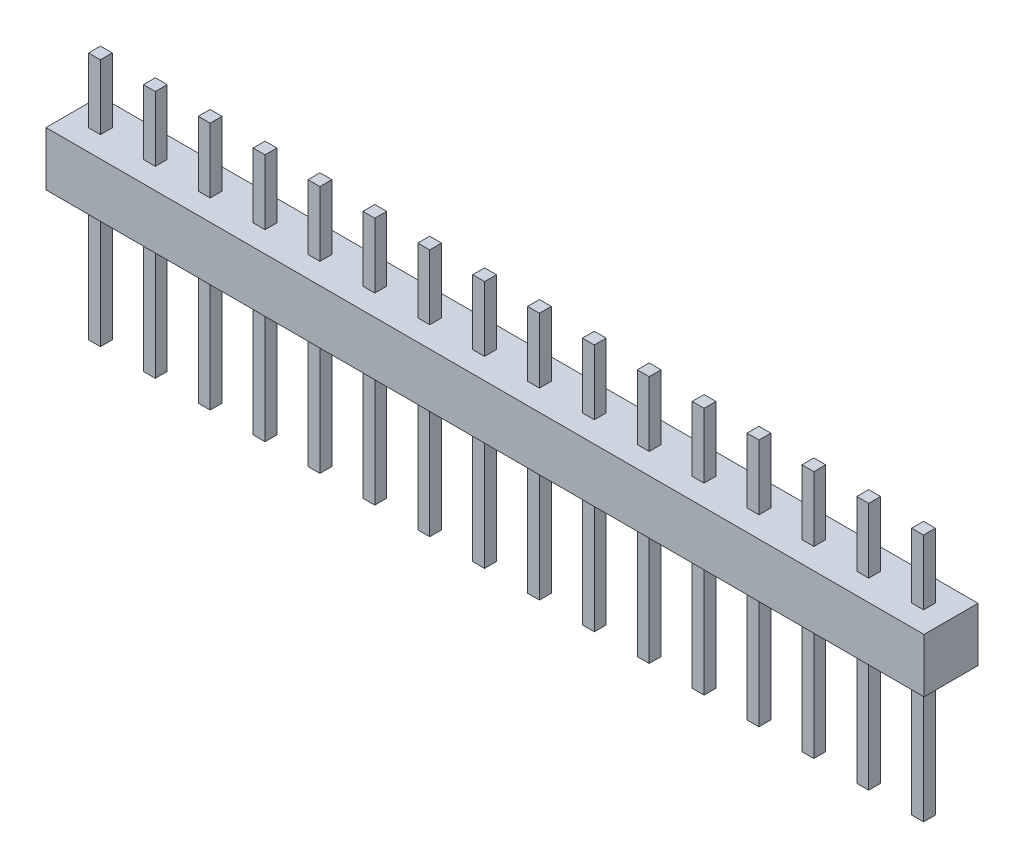
from build123d import *

# Parameters (mm, degrees)
SKETCH1_W              = 40.64
SKETCH1_H              = 2.5
BOSS_EXTRUDE1_DEPTH    = 1.25
SKETCH2_W              = 0.55
SKETCH2_H              = 0.55
BOSS_EXTRUDE2_DEPTH    = 6
BOSS_EXTRUDE2_2_DEPTH  = 6
BOSS_EXTRUDE2_3_DEPTH  = 6
BOSS_EXTRUDE2_4_DEPTH  = 6
BOSS_EXTRUDE2_5_DEPTH  = 6
BOSS_EXTRUDE2_6_DEPTH  = 6
BOSS_EXTRUDE2_7_DEPTH  = 6
BOSS_EXTRUDE2_8_DEPTH  = 6
BOSS_EXTRUDE2_9_DEPTH  = 6
BOSS_EXTRUDE2_10_DEPTH = 6
BOSS_EXTRUDE2_11_DEPTH = 6
BOSS_EXTRUDE2_12_DEPTH = 6
BOSS_EXTRUDE2_13_DEPTH = 6
BOSS_EXTRUDE2_14_DEPTH = 6
BOSS_EXTRUDE2_15_DEPTH = 6
BOSS_EXTRUDE2_16_DEPTH = 6
SKETCH2_2_W            = 0.55
SKETCH2_2_H            = 0.55
BOSS_EXTRUDE3_DEPTH    = 5.5
BOSS_EXTRUDE3_2_DEPTH  = 5.5
BOSS_EXTRUDE3_3_DEPTH  = 5.5
BOSS_EXTRUDE3_4_DEPTH  = 5.5
BOSS_EXTRUDE3_5_DEPTH  = 5.5
BOSS_EXTRUDE3_6_DEPTH  = 5.5
BOSS_EXTRUDE3_7_DEPTH  = 5.5
BOSS_EXTRUDE3_8_DEPTH  = 5.5
BOSS_EXTRUDE3_9_DEPTH  = 5.5
BOSS_EXTRUDE3_10_DEPTH = 5.5
BOSS_EXTRUDE3_11_DEPTH = 5.5
BOSS_EXTRUDE3_12_DEPTH = 5.5
BOSS_EXTRUDE3_13_DEPTH = 5.5
BOSS_EXTRUDE3_14_DEPTH = 5.5
BOSS_EXTRUDE3_15_DEPTH = 5.5
BOSS_EXTRUDE3_16_DEPTH = 5.5


with BuildPart() as part:
    # Sketch1 → Boss-Extrude1 (new, symmetric)
    with BuildSketch(Plane.XY):
        with Locations((20.32, 1.25)):
            Rectangle(SKETCH1_W, SKETCH1_H)
    extrude(amount=BOSS_EXTRUDE1_DEPTH, both=True)


with BuildPart() as body_2:
    # Sketch2 → Boss-Extrude2 (new body)
    with BuildSketch(Plane.XZ):
        with Locations((3.81, 0)):
            Rectangle(SKETCH2_W, SKETCH2_H)
    extrude(amount=BOSS_EXTRUDE2_DEPTH)


with BuildPart() as body_3:
    # Sketch2 → Boss-Extrude2 2 (new body)
    with BuildSketch(Plane.XZ):
        with Locations((1.27, 0)):
            Rectangle(SKETCH2_W, SKETCH2_H)
    extrude(amount=BOSS_EXTRUDE2_2_DEPTH)


with BuildPart() as body_4:
    # Sketch2 → Boss-Extrude2 3 (new body)
    with BuildSketch(Plane.XZ):
        with Locations((6.35, 0)):
            Rectangle(SKETCH2_W, SKETCH2_H)
    extrude(amount=BOSS_EXTRUDE2_3_DEPTH)


with BuildPart() as body_5:
    # Sketch2 → Boss-Extrude2 4 (new body)
    with BuildSketch(Plane.XZ):
        with Locations((8.89, 0)):
            Rectangle(SKETCH2_W, SKETCH2_H)
    extrude(amount=BOSS_EXTRUDE2_4_DEPTH)


with BuildPart() as body_6:
    # Sketch2 → Boss-Extrude2 5 (new body)
    with BuildSketch(Plane.XZ):
        with Locations((11.43, 0)):
            Rectangle(SKETCH2_W, SKETCH2_H)
    extrude(amount=BOSS_EXTRUDE2_5_DEPTH)


with BuildPart() as body_7:
    # Sketch2 → Boss-Extrude2 6 (new body)
    with BuildSketch(Plane.XZ):
        with Locations((13.97, 0)):
            Rectangle(SKETCH2_W, SKETCH2_H)
    extrude(amount=BOSS_EXTRUDE2_6_DEPTH)


with BuildPart() as body_8:
    # Sketch2 → Boss-Extrude2 7 (new body)
    with BuildSketch(Plane.XZ):
        with Locations((16.51, 0)):
            Rectangle(SKETCH2_W, SKETCH2_H)
    extrude(amount=BOSS_EXTRUDE2_7_DEPTH)


with BuildPart() as body_9:
    # Sketch2 → Boss-Extrude2 8 (new body)
    with BuildSketch(Plane.XZ):
        with Locations((19.05, 0)):
            Rectangle(SKETCH2_W, SKETCH2_H)
    extrude(amount=BOSS_EXTRUDE2_8_DEPTH)


with BuildPart() as body_10:
    # Sketch2 → Boss-Extrude2 9 (new body)
    with BuildSketch(Plane.XZ):
        with Locations((21.59, 0)):
            Rectangle(SKETCH2_W, SKETCH2_H)
    extrude(amount=BOSS_EXTRUDE2_9_DEPTH)


with BuildPart() as body_11:
    # Sketch2 → Boss-Extrude2 10 (new body)
    with BuildSketch(Plane.XZ):
        with Locations((24.13, 0)):
            Rectangle(SKETCH2_W, SKETCH2_H)
    extrude(amount=BOSS_EXTRUDE2_10_DEPTH)


with BuildPart() as body_12:
    # Sketch2 → Boss-Extrude2 11 (new body)
    with BuildSketch(Plane.XZ):
        with Locations((26.67, 0)):
            Rectangle(SKETCH2_W, SKETCH2_H)
    extrude(amount=BOSS_EXTRUDE2_11_DEPTH)


with BuildPart() as body_13:
    # Sketch2 → Boss-Extrude2 12 (new body)
    with BuildSketch(Plane.XZ):
        with Locations((29.21, 0)):
            Rectangle(SKETCH2_W, SKETCH2_H)
    extrude(amount=BOSS_EXTRUDE2_12_DEPTH)


with BuildPart() as body_14:
    # Sketch2 → Boss-Extrude2 13 (new body)
    with BuildSketch(Plane.XZ):
        with Locations((31.75, 0)):
            Rectangle(SKETCH2_W, SKETCH2_H)
    extrude(amount=BOSS_EXTRUDE2_13_DEPTH)


with BuildPart() as body_15:
    # Sketch2 → Boss-Extrude2 14 (new body)
    with BuildSketch(Plane.XZ):
        with Locations((34.29, 0)):
            Rectangle(SKETCH2_W, SKETCH2_H)
    extrude(amount=BOSS_EXTRUDE2_14_DEPTH)


with BuildPart() as body_16:
    # Sketch2 → Boss-Extrude2 15 (new body)
    with BuildSketch(Plane.XZ):
        with Locations((36.83, 0)):
            Rectangle(SKETCH2_W, SKETCH2_H)
    extrude(amount=BOSS_EXTRUDE2_15_DEPTH)


with BuildPart() as body_17:
    # Sketch2 → Boss-Extrude2 16 (new body)
    with BuildSketch(Plane.XZ):
        with Locations((39.37, 0)):
            Rectangle(SKETCH2_W, SKETCH2_H)
    extrude(amount=BOSS_EXTRUDE2_16_DEPTH)


with BuildPart() as body_18:
    # Sketch2<2> → Boss-Extrude3 (new body)
    with BuildSketch(Plane.XZ):
        with Locations((3.81, 0)):
            Rectangle(SKETCH2_2_W, SKETCH2_2_H)
    extrude(amount=-BOSS_EXTRUDE3_DEPTH)


with BuildPart() as body_19:
    # Sketch2<2> → Boss-Extrude3 2 (new body)
    with BuildSketch(Plane.XZ):
        with Locations((1.27, 0)):
            Rectangle(SKETCH2_2_W, SKETCH2_2_H)
    extrude(amount=-BOSS_EXTRUDE3_2_DEPTH)


with BuildPart() as body_20:
    # Sketch2<2> → Boss-Extrude3 3 (new body)
    with BuildSketch(Plane.XZ):
        with Locations((6.35, 0)):
            Rectangle(SKETCH2_2_W, SKETCH2_2_H)
    extrude(amount=-BOSS_EXTRUDE3_3_DEPTH)


with BuildPart() as body_21:
    # Sketch2<2> → Boss-Extrude3 4 (new body)
    with BuildSketch(Plane.XZ):
        with Locations((8.89, 0)):
            Rectangle(SKETCH2_2_W, SKETCH2_2_H)
    extrude(amount=-BOSS_EXTRUDE3_4_DEPTH)


with BuildPart() as body_22:
    # Sketch2<2> → Boss-Extrude3 5 (new body)
    with BuildSketch(Plane.XZ):
        with Locations((11.43, 0)):
            Rectangle(SKETCH2_2_W, SKETCH2_2_H)
    extrude(amount=-BOSS_EXTRUDE3_5_DEPTH)


with BuildPart() as body_23:
    # Sketch2<2> → Boss-Extrude3 6 (new body)
    with BuildSketch(Plane.XZ):
        with Locations((13.97, 0)):
            Rectangle(SKETCH2_2_W, SKETCH2_2_H)
    extrude(amount=-BOSS_EXTRUDE3_6_DEPTH)


with BuildPart() as body_24:
    # Sketch2<2> → Boss-Extrude3 7 (new body)
    with BuildSketch(Plane.XZ):
        with Locations((16.51, 0)):
            Rectangle(SKETCH2_2_W, SKETCH2_2_H)
    extrude(amount=-BOSS_EXTRUDE3_7_DEPTH)


with BuildPart() as body_25:
    # Sketch2<2> → Boss-Extrude3 8 (new body)
    with BuildSketch(Plane.XZ):
        with Locations((19.05, 0)):
            Rectangle(SKETCH2_2_W, SKETCH2_2_H)
    extrude(amount=-BOSS_EXTRUDE3_8_DEPTH)


with BuildPart() as body_26:
    # Sketch2<2> → Boss-Extrude3 9 (new body)
    with BuildSketch(Plane.XZ):
        with Locations((21.59, 0)):
            Rectangle(SKETCH2_2_W, SKETCH2_2_H)
    extrude(amount=-BOSS_EXTRUDE3_9_DEPTH)


with BuildPart() as body_27:
    # Sketch2<2> → Boss-Extrude3 10 (new body)
    with BuildSketch(Plane.XZ):
        with Locations((24.13, 0)):
            Rectangle(SKETCH2_2_W, SKETCH2_2_H)
    extrude(amount=-BOSS_EXTRUDE3_10_DEPTH)


with BuildPart() as body_28:
    # Sketch2<2> → Boss-Extrude3 11 (new body)
    with BuildSketch(Plane.XZ):
        with Locations((26.67, 0)):
            Rectangle(SKETCH2_2_W, SKETCH2_2_H)
    extrude(amount=-BOSS_EXTRUDE3_11_DEPTH)


with BuildPart() as body_29:
    # Sketch2<2> → Boss-Extrude3 12 (new body)
    with BuildSketch(Plane.XZ):
        with Locations((29.21, 0)):
            Rectangle(SKETCH2_2_W, SKETCH2_2_H)
    extrude(amount=-BOSS_EXTRUDE3_12_DEPTH)


with BuildPart() as body_30:
    # Sketch2<2> → Boss-Extrude3 13 (new body)
    with BuildSketch(Plane.XZ):
        with Locations((31.75, 0)):
            Rectangle(SKETCH2_2_W, SKETCH2_2_H)
    extrude(amount=-BOSS_EXTRUDE3_13_DEPTH)


with BuildPart() as body_31:
    # Sketch2<2> → Boss-Extrude3 14 (new body)
    with BuildSketch(Plane.XZ):
        with Locations((34.29, 0)):
            Rectangle(SKETCH2_2_W, SKETCH2_2_H)
    extrude(amount=-BOSS_EXTRUDE3_14_DEPTH)


with BuildPart() as body_32:
    # Sketch2<2> → Boss-Extrude3 15 (new body)
    with BuildSketch(Plane.XZ):
        with Locations((36.83, 0)):
            Rectangle(SKETCH2_2_W, SKETCH2_2_H)
    extrude(amount=-BOSS_EXTRUDE3_15_DEPTH)


with BuildPart() as body_33:
    # Sketch2<2> → Boss-Extrude3 16 (new body)
    with BuildSketch(Plane.XZ):
        with Locations((39.37, 0)):
            Rectangle(SKETCH2_2_W, SKETCH2_2_H)
    extrude(amount=-BOSS_EXTRUDE3_16_DEPTH)


solid = Compound([part.part, body_2.part, body_3.part, body_4.part, body_5.part, body_6.part, body_7.part, body_8.part, body_9.part, body_10.part, body_11.part, body_12.part, body_13.part, body_14.part, body_15.part, body_16.part, body_17.part, body_18.part, body_19.part, body_20.part, body_21.part, body_22.part, body_23.part, body_24.part, body_25.part, body_26.part, body_27.part, body_28.part, body_29.part, body_30.part, body_31.part, body_32.part, body_33.part])
